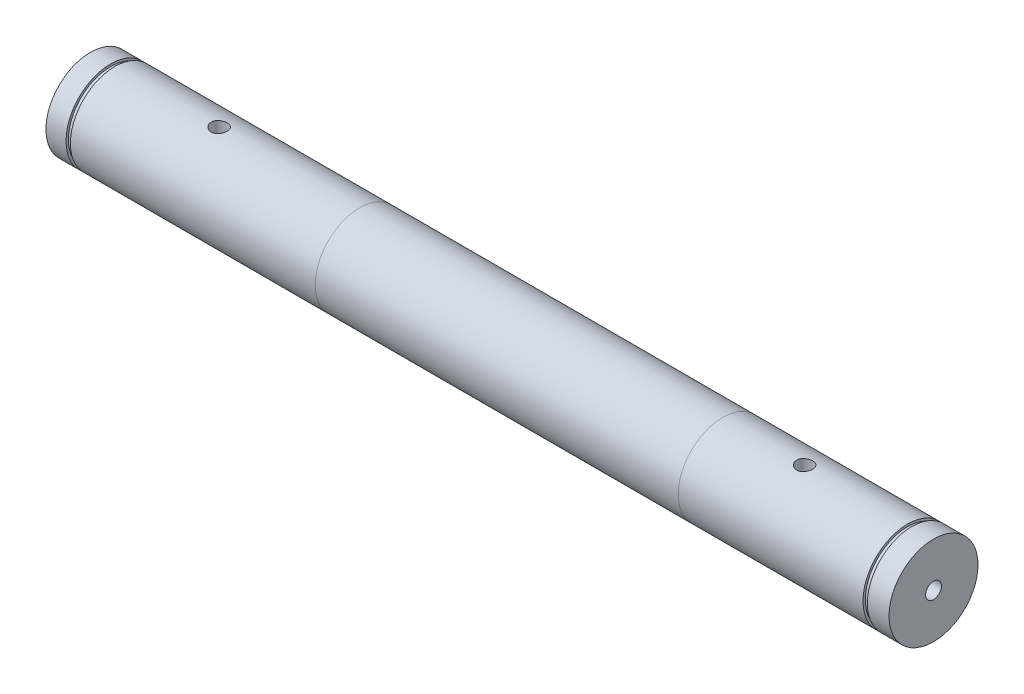
from build123d import *

# Parameters (mm, degrees)
M8_GEWINDEBOHRUNG1_D          = 6.8
M8_GEWINDEBOHRUNG1_DEPTH      = 325
M8_GEWINDEBOHRUNG1_TIP        = 2.042926105
SKIZZE18_W                    = 3.4
SKIZZE18_H                    = 27
M8_GEWINDEBOHRUNG3_AT_2_COUNT = 2
M8_GEWINDEBOHRUNG3_AT_2_PITCH = 250
SPIEGELN2_COPY_1_SKETCH_W     = 3.4
SPIEGELN2_COPY_1_SKETCH_H     = 27
SKIZZE19_W                    = 1.85
SKIZZE19_H                    = 1
SKIZZE20_W                    = 1.85
SKIZZE20_H                    = 1
SKETCH1_W                     = 21.407583332
SKETCH1_H                     = 15.084330907


with BuildPart() as part:
    # Skizze1 → Rotation1 (revolve)
    with BuildSketch(Plane.XY, mode=Mode.PRIVATE) as rotation1_sk:
        Polygon((180, 19), (180, 0), (-180, 0), (-180, 19), (-65, 19), (-65, 27), (-60, 27), (-60, 19.0001), (90, 19.0001), align=None)
    revolve(rotation1_sk.sketch.rotate(Axis((180, 0, 0), (-1, 0, 0)), 90), axis=Axis((180, 0, 0), (-1, 0, 0)))

    # M8 Gewindebohrung1
    with Locations(Plane(origin=(180, 0, 0), x_dir=(0, 0, -1), z_dir=(1, 0, 0))):
        with Locations((0, 0)):
            Hole(M8_GEWINDEBOHRUNG1_D / 2, depth=M8_GEWINDEBOHRUNG1_DEPTH)
            with Locations((0, 0, -(M8_GEWINDEBOHRUNG1_DEPTH + M8_GEWINDEBOHRUNG1_TIP / 2))):  # 118° drill point
                Cone(0, M8_GEWINDEBOHRUNG1_D / 2, M8_GEWINDEBOHRUNG1_TIP, mode=Mode.SUBTRACT)

    # Skizze18 → M8 Gewindebohrung3 (revolve, cut)
    with BuildSketch(Plane(origin=(-125, 0, 0), x_dir=(0, 0, -1), z_dir=(1, 0, 0))):
        with Locations((1.7, 13.5)):
            Rectangle(SKIZZE18_W, SKIZZE18_H)
    m8_gewindebohrung3 = revolve(axis=Axis((-125, -6.35, 0), (0, 1, 0)), mode=Mode.SUBTRACT)

    # M8 Gewindebohrung3 at 2: M8 Gewindebohrung3 ×2
    with Locations(*[(i * M8_GEWINDEBOHRUNG3_AT_2_PITCH, 0, 0) for i in range(1, M8_GEWINDEBOHRUNG3_AT_2_COUNT)]):
        add(m8_gewindebohrung3, mode=Mode.SUBTRACT)

    # Spiegeln2: M8 Gewindebohrung3 across plane
    add(m8_gewindebohrung3.mirror(Plane.ZX), mode=Mode.SUBTRACT)

    # Spiegeln2 copy 1 sketch → Spiegeln2 copy 1 (revolve, cut)
    with BuildSketch(Plane(origin=(125, 0, 0), x_dir=(0, 0, -1), z_dir=(1, 0, 0))):
        with Locations((1.7, -13.5)):
            Rectangle(SPIEGELN2_COPY_1_SKETCH_W, SPIEGELN2_COPY_1_SKETCH_H)
    revolve(axis=Axis((125, 6.35, 0), (0, 1, 0)), mode=Mode.SUBTRACT)

    # Skizze19 → Schnitt-Rotation1 (revolve, cut)
    with BuildSketch(Plane.XY, mode=Mode.PRIVATE) as schnitt_rotation1_sk:
        with Locations((169.825, 18.5)):
            Rectangle(SKIZZE19_W, SKIZZE19_H)
    revolve(schnitt_rotation1_sk.sketch.rotate(Axis((-88.99, 0, 0), (1, 0, 0)), 270), axis=Axis((-88.99, 0, 0), (1, 0, 0)), mode=Mode.SUBTRACT)

    # Skizze20 → Schnitt-Rotation2 (revolve, cut)
    with BuildSketch(Plane.XY, mode=Mode.PRIVATE) as schnitt_rotation2_sk:
        with Locations((-170.475, 18.5)):
            Rectangle(SKIZZE20_W, SKIZZE20_H)
    revolve(schnitt_rotation2_sk.sketch.rotate(Axis((-88.99, 0, 0), (1, 0, 0)), 270), axis=Axis((-88.99, 0, 0), (1, 0, 0)), mode=Mode.SUBTRACT)

    # Sketch1 → Cut-Revolve1 (revolve, cut)
    with BuildSketch(Plane.XY, mode=Mode.PRIVATE) as cut_revolve1_sk:
        with Locations((-62.803513507, 26.542265454)):
            Rectangle(SKETCH1_W, SKETCH1_H)
    revolve(cut_revolve1_sk.sketch.rotate(Axis((-202.232213843, 0, 0), (1, 0, 0)), 270), axis=Axis((-202.232213843, 0, 0), (1, 0, 0)), mode=Mode.SUBTRACT)


solid = part.part
